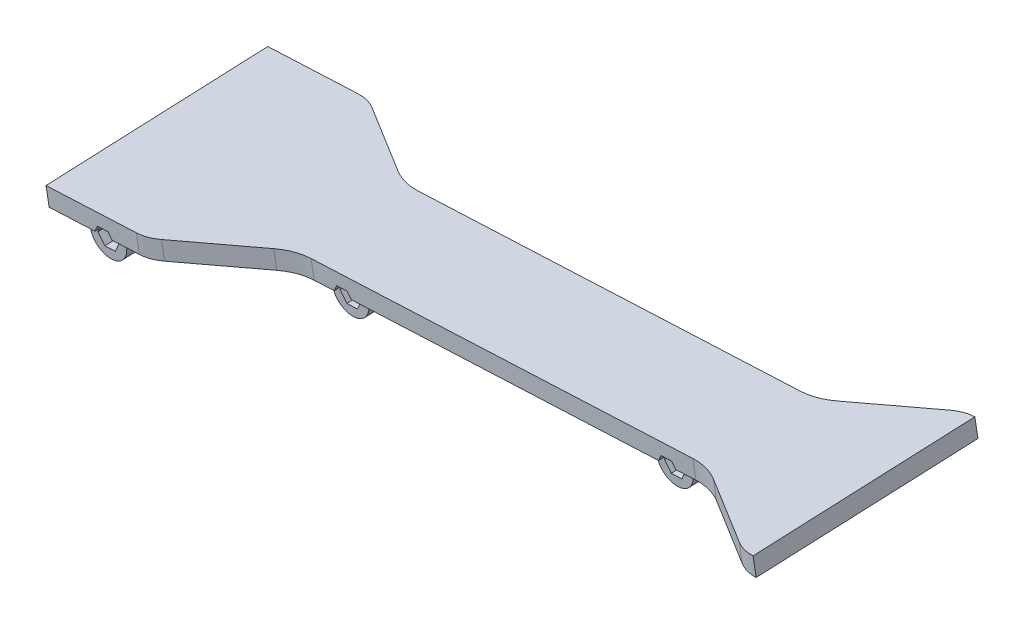
from build123d import *

# Parameters (mm, degrees)
EXTRUDE_1_DEPTH     = 5
SKETCH_2_R          = 5.000000000012101
EXTRUDE_3_DEPTH     = 27.5
CUT_EXTRUDE_1_DEPTH = 59.80000000000002
SKETCH_4_R          = 5.0000000000065405
SKETCH_4_R_2        = 5.000000000006525
EXTRUDE_4_DEPTH     = 12
CUT_EXTRUDE_2_DEPTH = 39.00000000000001
FILLET_1_R          = 2


with BuildPart() as part:
    # 草图1 → 凸台-拉伸1 (new body)
    with BuildSketch(Plane(origin=(-35.95282664063733, 399.74242683802464, 30.566209896758863), x_dir=(0.9960030029050825, 0.08905977205298914, 0.006809934355634975), z_dir=(-0.0893197525973871, 0.9931039643902259, 0.07593745919082788))):
        with BuildLine():
            Line((300.07791562372654, -1129.6042951871439), (302.10510848643986, -1072.2401034897346))
            Line((302.10510848643986, -1072.2401034897346), (327.3060115945207, -1073.1306780695022))
            ThreePointArc((327.3060115945207, -1073.1306780695022), (330.1251349541227, -1073.6036481637962), (332.72578534648983, -1074.7901450088955))
            Line((332.72578534648983, -1074.7901450088955), (351.6029613751, -1086.5968806615322))
            ThreePointArc((351.6029613751, -1086.5968806615322), (355.4148735940491, -1088.3359924755819), (359.5470133129178, -1089.029250011054))
            Line((359.5470133129178, -1089.029250011054), (465.98440043114425, -1092.7906402635294))
            ThreePointArc((465.98440043114425, -1092.7906402635294), (470.1551691567732, -1092.390799165044), (474.0803358930331, -1090.9251079426926))
            Line((474.0803358930331, -1090.9251079426926), (493.74385691829394, -1080.480361776527))
            ThreePointArc((493.74385691829394, -1080.480361776527), (496.42177441125835, -1079.4804042136147), (499.26725213995996, -1079.2076154267972))
            Line((499.26725213995996, -1079.2076154267972), (497.24005927724687, -1136.5718071242063))
            ThreePointArc((497.24005927724687, -1136.5718071242063), (494.4209359176449, -1136.0988370299121), (491.8202855252778, -1134.9123401848128))
            Line((491.8202855252778, -1134.9123401848128), (472.9431094966676, -1123.1056045321764))
            ThreePointArc((472.9431094966676, -1123.1056045321764), (469.13119727771857, -1121.3664927181267), (464.9990575588499, -1120.6732351826547))
            Line((464.9990575588499, -1120.6732351826547), (358.5616704406234, -1116.9118449301766))
            ThreePointArc((358.5616704406234, -1116.9118449301766), (354.39090171499237, -1117.3116860286625), (350.4657349787294, -1118.777377251013))
            Line((350.4657349787294, -1118.777377251013), (330.80221395347337, -1129.222123417182))
            ThreePointArc((330.80221395347337, -1129.222123417182), (328.12429646050896, -1130.2220809800938), (325.2788187318076, -1130.494869766911))
            Line((325.2788187318076, -1130.494869766911), (300.07791562372654, -1129.6042951871439))
        make_face()
    extrude(amount=-EXTRUDE_1_DEPTH)

    # 草图2 → 凸台-拉伸3 (add, symmetric)
    with BuildSketch(Plane(origin=(-38.327599823670674, -86.44895602357099, 1085.4904824160742), x_dir=(0.9993811405079088, -0.0027925735986703876, 0.03506476193855483), z_dir=(-0.03517578708588501, -0.07933995566829466, 0.9962267991965693))):
        with Locations((318.1419856303242, 426.65964110326615)):
            Circle(SKETCH_2_R)
    extrude(amount=EXTRUDE_3_DEPTH, both=True)

    # 草图3 → 切除-拉伸1 (cut)
    with BuildSketch(Plane(origin=(-39.33714491302575, -88.72601275125034, 1114.0821915530184), x_dir=(0.9993811405079092, -0.002792573598669658, 0.03506476193854602), z_dir=(-0.03517578708587617, -0.07933995566829388, 0.9962267991965696))):
        Polygon((321.1034402768945, 426.9253847947825), (319.3925721658551, 429.35720790511795), (316.43111751927484, 429.0914642136009), (315.18053098373395, 426.39389741174824), (316.8913990947733, 423.9620743014128), (319.8528537413536, 424.2278179929299), align=None)
    extrude(amount=-CUT_EXTRUDE_1_DEPTH, mode=Mode.SUBTRACT)

    # 草图4 → 凸台-拉伸4 (add, symmetric)
    with BuildSketch(Plane(origin=(-38.327599823670674, -86.44895602357099, 1085.4904824160742), x_dir=(0.9993811405079088, -0.0027925735986703876, 0.03506476193855483), z_dir=(-0.03517578708588501, -0.07933995566829466, 0.9962267991965693))):
        with Locations((368.7211342547294, 431.1983193115499)):
            Circle(SKETCH_4_R)
        with Locations((458.86276991896267, 439.2871046820992)):
            Circle(SKETCH_4_R_2)
    extrude(amount=EXTRUDE_4_DEPTH, both=True)

    # 草图5 → 切除-拉伸2 (cut)
    with BuildSketch(Plane(origin=(-38.81830205352909, -87.55574840514421, 1099.3878462648613), x_dir=(0.9993811405079085, -0.002792573598671172, 0.0350647619385643), z_dir=(-0.035175787085894514, -0.07933995566829542, 0.9962267991965689))):
        Polygon((369.9717207902861, 433.8958861133999), (367.01026614370573, 433.6301424218828), (365.75967960816484, 430.9325756200302), (367.47054771920426, 428.5007525096948), (370.4320023657846, 428.7664962012118), (371.6825889013256, 431.46406300306455), align=None)
        Polygon((460.1133564545191, 441.9846714839496), (457.1519018079389, 441.7189277924325), (455.90131527239805, 439.02136099058004), (457.61218338343764, 436.58953788024445), (460.57363803001766, 436.8552815717618), (461.82422456555855, 439.5528483736145), align=None)
    extrude(amount=-CUT_EXTRUDE_2_DEPTH, mode=Mode.SUBTRACT)

    # 圆角1
    fillet_1_edges = [part.edges().sort_by_distance(p)[0] for p in [
        (415.285524437343, 350.7404864262651, 1136.3250812261313),
        (425.0382330865837, 351.5861636609777, 1136.7367898828338),
        (325.19967377997307, 342.9289587973129, 1132.5221249504996),
        (334.952382429214, 343.7746360320256, 1132.9338336072021),
        (274.6518265417908, 338.545851989709, 1130.3882576287017),
        (284.4045351910414, 339.3915292244225, 1130.7999662854045),
    ]]
    fillet(fillet_1_edges, radius=FILLET_1_R)

    # 切除-扫描1: sweep along a curve in space
    with BuildLine() as sweep_1_path:
        Line((290.044943776391, 347.0743828700847, 1102.8022885042362), (264.94476860482246, 344.89789554811915, 1101.7426895995065))
        ThreePointArc((295.44305470841834, 347.43054527632216, 1104.493833582377), (292.8527991081144, 347.28939307381154, 1103.2930799825197), (290.044943776391, 347.0743828700847, 1102.8022885042362))
        Line((314.24477871928195, 348.21157078080637, 1116.3947560242318), (295.44305470841834, 347.43054527632216, 1104.493833582377))
        ThreePointArc((322.1570783045824, 348.73361704748316, 1118.8741440154793), (318.0414547361659, 348.4184651050343, 1118.1547647253926), (314.24477871928195, 348.21157078080637, 1116.3947560242318))
        Line((428.16903549570674, 357.926129817856, 1123.34941771218), (322.1570783045824, 348.73361704748316, 1118.8741440154793))
        ThreePointArc((436.23261152707437, 358.7893842711662, 1121.5444481339446), (432.32313367085544, 358.32806229446095, 1122.979143081403), (428.16903549570674, 357.926129817856, 1123.34941771218))
        Line((455.8175375159207, 361.33694338754674, 1111.264010490222), (436.23261152707437, 358.7893842711662, 1121.5444481339446))
        ThreePointArc((461.31885574293176, 361.925892687469, 1110.0325826471264), (458.4847513804454, 361.6516770725888, 1110.2851999185907), (455.8175375159207, 361.33694338754674, 1111.264010490222))
    # 草图8 → 切除-扫描1 (sweep, cut)
    with BuildSketch(Plane(origin=(534.589737117881, 46.35536514533573, 22.567599471235773), x_dir=(0.04186275100976178, 0.0036300044207879887, -0.9991167765310519), z_dir=(0.9953816583596613, 0.08631157133878511, 0.042019838816923734))):
        Polygon((-1088.4263068343075, 320.7205078186499), (-1088.5260175810986, 320.71290735982717), (-1088.145994639964, 315.7273700202607), (-1088.046283893173, 315.7349704790834), align=None)
    sweep_1 = sweep(path=sweep_1_path.line, mode=Mode.SUBTRACT)

    # 镜向2: 切除-扫描1 across plane
    add(sweep_1.mirror(Plane(origin=(-38.327599823670674, -86.44895602357099, 1085.4904824160742), x_dir=(0.9993811405079088, -0.002792573598670388, 0.035064761938554824), z_dir=(-0.035175787085885, -0.07933995566829465, 0.9962267991965692))), mode=Mode.SUBTRACT)

    # 镜向3: part across plane


with BuildPart() as part_1:
    add(part.part)
    add(part.part.mirror(Plane(origin=(-38.327599823670674, -86.44895602357099, 1085.4904824160742), x_dir=(0.9993811405079088, -0.002792573598670388, 0.035064761938554824), z_dir=(-0.035175787085885, -0.07933995566829465, 0.9962267991965692))))


solid = part_1.part
